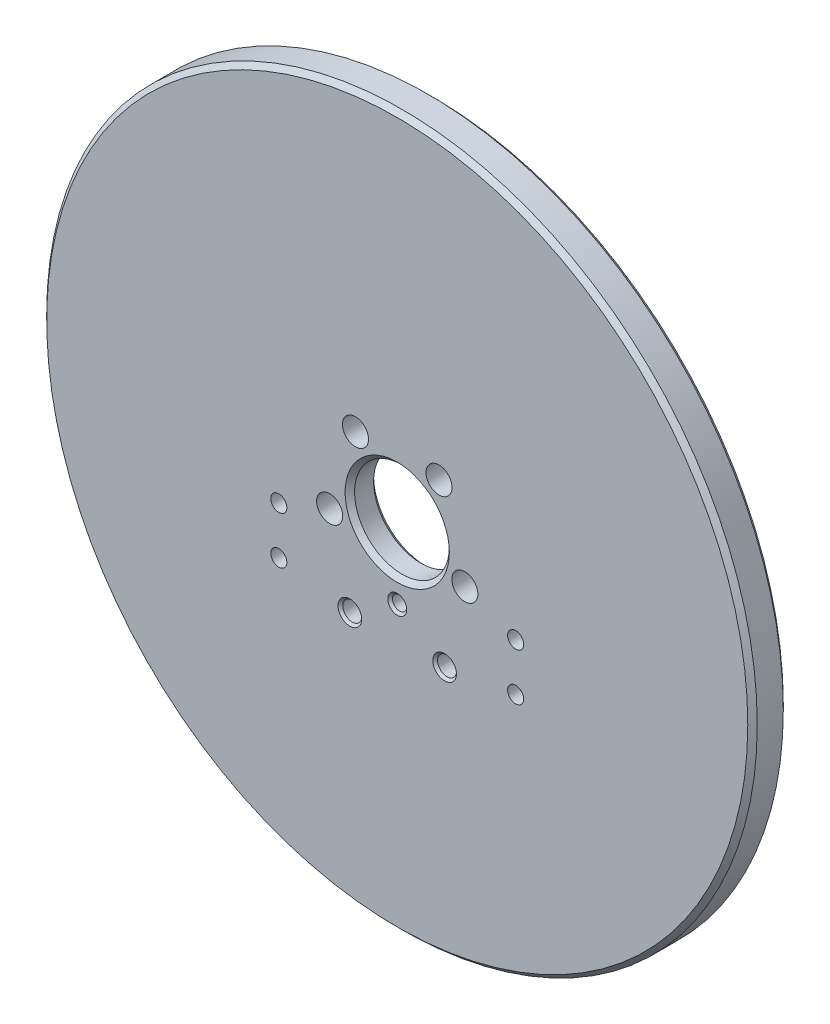
from build123d import *

# Parameters (mm, degrees)
SKETCH_2_R                = 150
EXTRUDE_1_DEPTH           = 15
SKETCH_3_R                = 35
CUT_EXTRUDE_1_DEPTH       = 3
EXTRUDE_START             = 16.5
SKETCH_4_R                = 38.5
SKETCH_4_R_2              = 35
EXTRUDE_2_DEPTH           = 16.5
EXTRUDE_START_2           = 13.5
SKETCH_5_R                = 46.5
SKETCH_5_R_2              = 38.5
EXTRUDE_3_DEPTH           = 13.5
CHAMFER_1_SIZE            = 0.5
HOLE_WIZARD_1_D           = 6.6
HOLE_WIZARD_1_CBORE_D     = 11
HOLE_WIZARD_1_CBORE_DEPTH = 8
HOLE_WIZARD_6_0_6_1_D     = 6
CHAMFER_3_SIZE            = 1
CUT_EXTRUDE_START         = 69
SKETCH_20_R               = 46.5
CUT_EXTRUDE_5_DEPTH       = 69
SKETCH_22_R               = 4
CUT_EXTRUDE_7_DEPTH       = 244.812402925
CHAMFER_6_SIZE            = 1
HOLE_WIZARD_M8_1_D        = 6.8
EXTRUDE_START_3           = 5
SKETCH_27_R               = 40
SKETCH_27_R_2             = 35
EXTRUDE_4_DEPTH           = 5
CHAMFER_7_SIZE            = 0.5
CHAMFER_8_SIZE            = 2
SKETCH_25_R               = 20
CUT_EXTRUDE_8_DEPTH       = 245.171021663
CHAMFER_9_SIZE            = 2
FILLET_1_R                = 1


with BuildPart() as part:
    # 草图2 → 凸台-拉伸1 (new body)
    with BuildSketch(Plane.XY.offset(1)):
        with Locations((18.556612769, -25.522523089)):
            Circle(SKETCH_2_R)
    extrude(amount=EXTRUDE_1_DEPTH)

    # 草图3 → 切除-拉伸1 (cut)
    with BuildSketch(Plane(origin=(0, 0, 1), x_dir=(-1, 0, 0), z_dir=(0, 0, -1))):
        with Locations((-18.556612769, -25.522523089)):
            Circle(SKETCH_3_R)
    extrude(amount=-CUT_EXTRUDE_1_DEPTH, mode=Mode.SUBTRACT)

    # 草图4 → 凸台-拉伸2 (add)
    with BuildSketch(Plane(origin=(0, 0, 1), x_dir=(-1, 0, 0), z_dir=(0, 0, -1)).offset(EXTRUDE_START)):
        with Locations(Location((-18.556612769, -25.522523089, 0), (0, 0, 180))):
            Circle(SKETCH_4_R)
        with Locations((-18.556612769, -25.522523089)):
            Circle(SKETCH_4_R_2, mode=Mode.SUBTRACT)
    extrude(amount=-EXTRUDE_2_DEPTH)

    # 草图5 → 凸台-拉伸3 (add)
    with BuildSketch(Plane(origin=(0, 0, 1), x_dir=(-1, 0, 0), z_dir=(0, 0, -1)).offset(EXTRUDE_START_2)):
        with Locations(Location((-18.556612769, -25.522523089, 0), (0, 0, 180))):
            Circle(SKETCH_5_R)
        with Locations(Location((-18.556612769, -25.522523089, 0), (0, 0, 90))):
            Circle(SKETCH_5_R_2, mode=Mode.SUBTRACT)
    extrude(amount=-EXTRUDE_3_DEPTH)

    # 倒角1
    chamfer_1_edges = [part.edges().sort_by_distance(p)[0] for p in [
        (53.556612769, -25.522523089, -15.5),
        (-19.943387231, -25.522523089, -15.5),
    ]]
    chamfer(chamfer_1_edges, length=CHAMFER_1_SIZE)

    # 打孔尺寸根据内六角圆柱头螺钉的类型1 (through all)
    with Locations(Plane(origin=(42.626407432, -13.463363362, 16), x_dir=(1, 0, 0), z_dir=(0, 0, 1))):
        with Locations((-41.703352232, 12.211350104), (-6.436237094, 12.211350104), (4.461900826, -21.329669558), (-52.601490152, -21.329669558)):
            CounterBoreHole(HOLE_WIZARD_1_D / 2, HOLE_WIZARD_1_CBORE_D / 2, HOLE_WIZARD_1_CBORE_DEPTH)

    # Ø6.0 (6) 直径孔1 (through all)
    with Locations(Plane.XY.offset(16)):
        with Locations((18.556612769, -55.522523089)):
            Hole(HOLE_WIZARD_6_0_6_1_D / 2)

    # 倒角3
    chamfer_3_edges = [part.edges().sort_by_distance(p)[0] for p in [
        (21.556612769, -55.522523089, 16),
    ]]
    chamfer(chamfer_3_edges, length=CHAMFER_3_SIZE)

    # 草图20 → 切除-拉伸5 (cut)
    with BuildSketch(Plane(origin=(0, 0, 1), x_dir=(-1, 0, 0), z_dir=(0, 0, -1)).offset(CUT_EXTRUDE_START)):
        with Locations((-18.556612769, -25.522523089)):
            Circle(SKETCH_20_R)
    extrude(amount=-CUT_EXTRUDE_5_DEPTH, mode=Mode.SUBTRACT)

    # 草图22 → 切除-拉伸7 (cut, through all)
    with BuildSketch(Plane.XY.offset(16)):
        with Locations((-1.443387231, -68.522523089)):
            Circle(SKETCH_22_R)
        with Locations((38.556612769, -68.522523089)):
            Circle(SKETCH_22_R)
    extrude(amount=-CUT_EXTRUDE_7_DEPTH, mode=Mode.SUBTRACT)

    # 倒角6
    chamfer_6_edges = [part.edges().sort_by_distance(p)[0] for p in [
        (-5.443387231, -68.522523089, 16),
        (34.556612769, -68.522523089, 16),
    ]]
    chamfer(chamfer_6_edges, length=CHAMFER_6_SIZE)

    # M8 螺纹孔1 (through all)
    with Locations(Plane.XY.offset(16)):
        with Locations((-31.443387231, -43.522523089), (-31.443387231, -63.522523089), (68.556612769, -43.522523089), (68.556612769, -63.522523089), (18.556612769, -25.522523089)):
            Hole(HOLE_WIZARD_M8_1_D / 2)

    # 草图27 → 凸台-拉伸4 (add)
    with BuildSketch(Plane(origin=(0, 0, 1), x_dir=(-1, 0, 0), z_dir=(0, 0, -1)).offset(EXTRUDE_START_3)):
        with Locations(Location((-18.556612769, -25.522523089, 0), (0, 0, 180))):
            Circle(SKETCH_27_R)
        with Locations((-18.556612769, -25.522523089)):
            Circle(SKETCH_27_R_2, mode=Mode.SUBTRACT)
    extrude(amount=-EXTRUDE_4_DEPTH)

    # 倒角7
    chamfer_7_edges = [part.edges().sort_by_distance(p)[0] for p in [
        (53.556612769, -25.522523089, -4),
    ]]
    chamfer(chamfer_7_edges, length=CHAMFER_7_SIZE)

    # 倒角8
    chamfer_8_edges = [part.edges().sort_by_distance(p)[0] for p in [
        (-131.443387231, -25.522523089, 1),
        (-131.443387231, -25.522523089, 16),
    ]]
    chamfer(chamfer_8_edges, length=CHAMFER_8_SIZE)

    # 草图25 → 切除-拉伸8 (cut, through all)
    with BuildSketch(Plane.XY.offset(16)):
        with Locations((18.556612769, -25.522523089)):
            Circle(SKETCH_25_R)
    extrude(amount=-CUT_EXTRUDE_8_DEPTH, mode=Mode.SUBTRACT)

    # 倒角9
    chamfer_9_edges = [part.edges().sort_by_distance(p)[0] for p in [
        (-1.443387231, -25.522523089, 4),
        (-1.443387231, -25.522523089, 16),
    ]]
    chamfer(chamfer_9_edges, length=CHAMFER_9_SIZE)

    # 圆角1
    fillet_1_edges = [part.edges().sort_by_distance(p)[0] for p in [
        (-21.443387231, -25.522523089, 1),
    ]]
    fillet(fillet_1_edges, radius=FILLET_1_R)


solid = part.part
